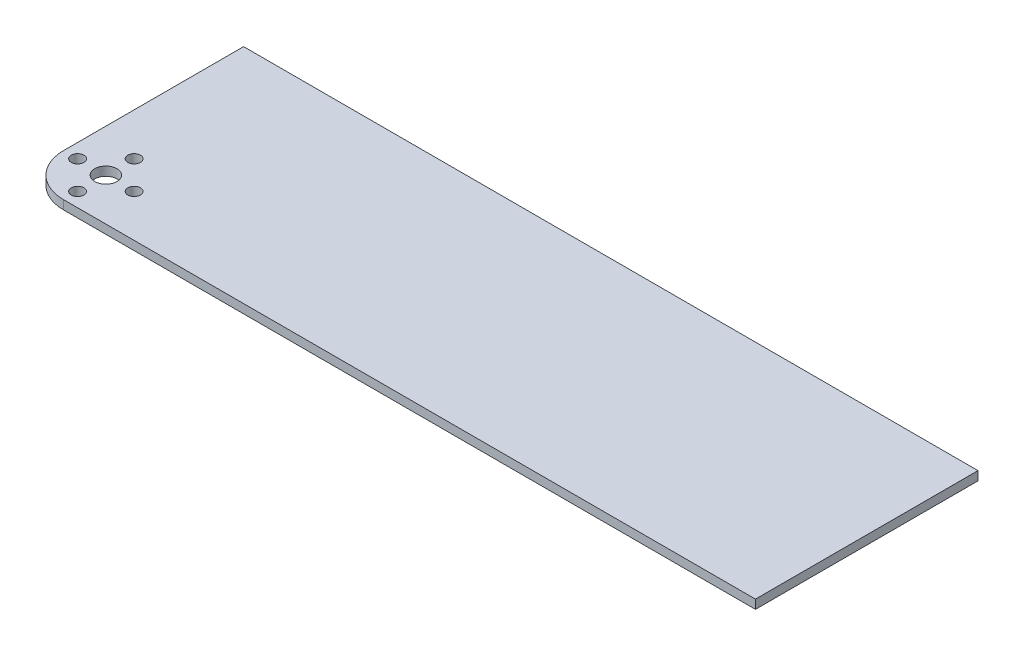
from build123d import *

# Parameters (mm, degrees)
BOSS_EXTRUDE1_DEPTH = 2
SKETCH2_R           = 1.42
CUT_EXTRUDE2_DEPTH  = 6.35


with BuildPart() as part:
    # Sketch1 → Boss-Extrude1 (new body)
    with BuildSketch(Plane(origin=(0, 0, 0), x_dir=(1, 0, 0), z_dir=(0, 1, 0))):
        with BuildLine():
            Line((-82.5, 25), (-82.5, -15.475))
            ThreePointArc((-82.5, -15.475), (-79.710192091, -22.210192091), (-72.975, -25))
            Line((-72.975, -25), (82.5, -25))
            Line((82.5, -25), (82.5, 25))
            Line((82.5, 25), (-82.5, 25))
        make_face()
    extrude(amount=BOSS_EXTRUDE1_DEPTH)

    # Sketch2 → Cut-Extrude2 (cut)
    with BuildSketch(Plane(origin=(0, 2, 0), x_dir=(1, 0, 0), z_dir=(0, 1, 0))):
        with BuildLine():
            ThreePointArc((-68.045, -15.475), (-66.625, -16.895), (-65.205, -15.475))
            Line((-65.205, -15.475), (-68.045, -15.475))
        make_face()
        with BuildLine():
            Line((-68.045, -15.475), (-65.205, -15.475))
            ThreePointArc((-65.205, -15.475), (-66.625, -14.055), (-68.045, -15.475))
        make_face()
        with Locations(Location((-72.975, -9.125, 0), (0, 0, 270))):
            Circle(SKETCH2_R)
        with BuildLine():
            ThreePointArc((-77.905, -15.475), (-79.325, -14.055), (-80.745, -15.475))
            Line((-80.745, -15.475), (-77.905, -15.475))
        make_face()
        with BuildLine():
            Line((-77.905, -15.475), (-80.745, -15.475))
            ThreePointArc((-80.745, -15.475), (-79.325, -16.895), (-77.905, -15.475))
        make_face()
        with Locations(Location((-72.975, -21.825, 0), (0, 0, 270))):
            Circle(SKETCH2_R)
        with BuildLine():
            ThreePointArc((-75.475, -15.475), (-72.975, -17.975), (-70.475, -15.475))
            Line((-70.475, -15.475), (-75.475, -15.475))
        make_face()
        with BuildLine():
            Line((-75.475, -15.475), (-70.475, -15.475))
            ThreePointArc((-70.475, -15.475), (-72.975, -12.975), (-75.475, -15.475))
        make_face()
    extrude(amount=-CUT_EXTRUDE2_DEPTH, mode=Mode.SUBTRACT)


solid = part.part
